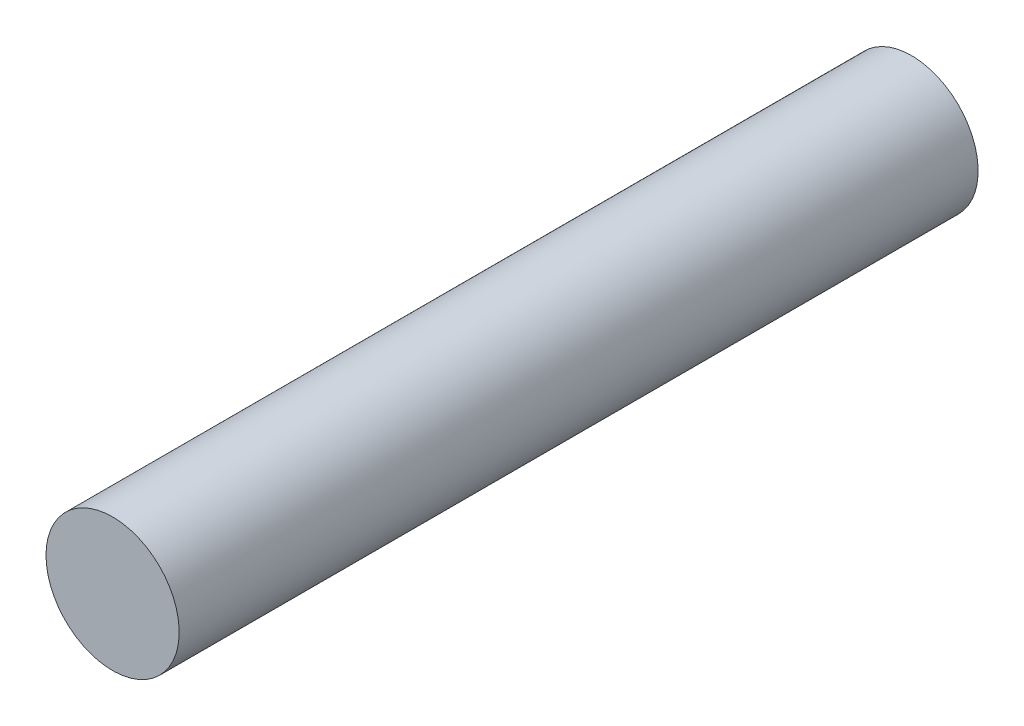
from build123d import *

# Parameters (mm, degrees)
SKETCH1_R           = 1.5875
BOSS_EXTRUDE1_DEPTH = 19.05


with BuildPart() as part:
    # Sketch1 → Boss-Extrude1 (new body)
    with BuildSketch(Plane.XY):
        with Locations(Location((0, 0, 0), (0, 0, 180))):
            Circle(SKETCH1_R)
    extrude(amount=BOSS_EXTRUDE1_DEPTH)


solid = part.part
